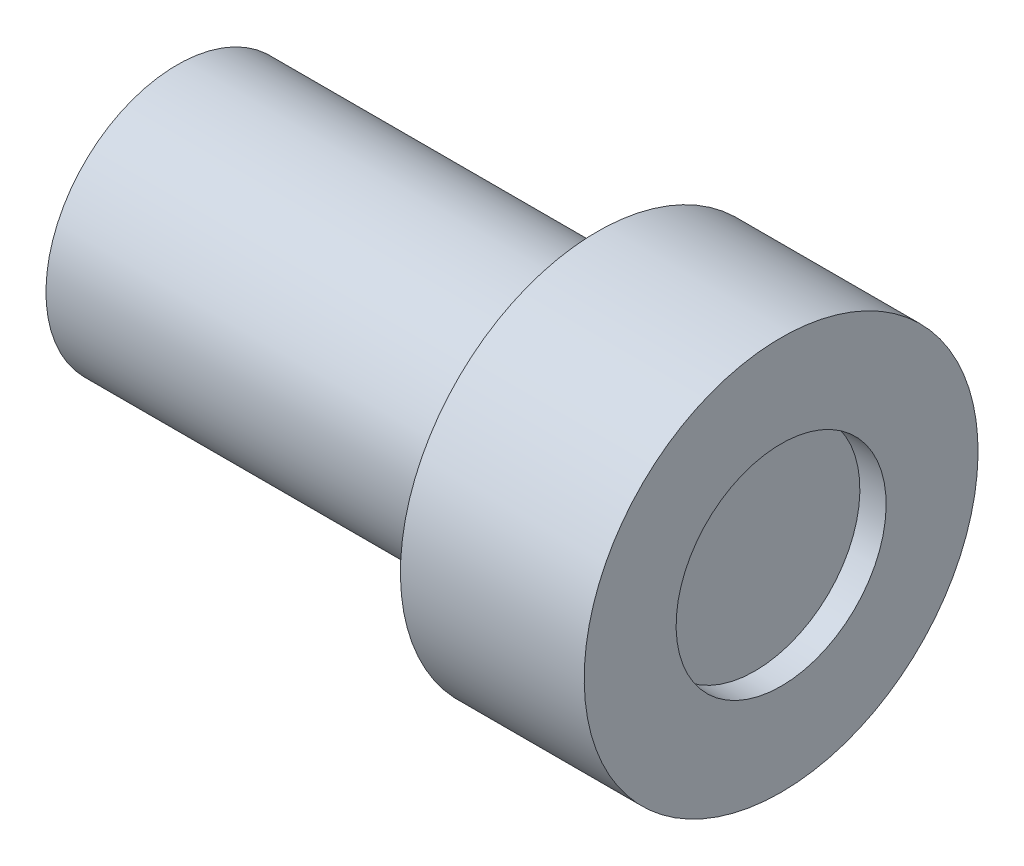
from build123d import *

# Parameters (mm, degrees)
ESBO_O2_W             = 1.2
ESBO_O2_H             = 1.2
CORTE_EXTRUS_O1_DEPTH = 1


with BuildPart() as part:
    # Esboço1 → Revolução1 (revolve)
    with BuildSketch(Plane(origin=(0, 0, 0), x_dir=(0, 1, 0), z_dir=(0, 0, 1))):
        Polygon((0, 5.5), (-2.5, 5.5), (-2.5, -2.5), (-3.75, -2.5), (-3.75, -3.560606061), (-3.75, -6), (-2, -6), (-2, -5.5), (0, -5.5), align=None)
    revolve(axis=Axis((-5.5, 0, 0), (1, 0, 0)))

    # Esboço2 → Corte-extrusão1 (cut)
    with BuildSketch(Plane.ZY.offset(5.5)):
        Polygon((-0.66395281, -1.15), (1.327905619, 0), (-0.66395281, 1.15), align=None)
        with Locations((-1.26395281, 0)):
            Rectangle(ESBO_O2_W, ESBO_O2_H)
    extrude(amount=-CORTE_EXTRUS_O1_DEPTH, mode=Mode.SUBTRACT)


solid = part.part
